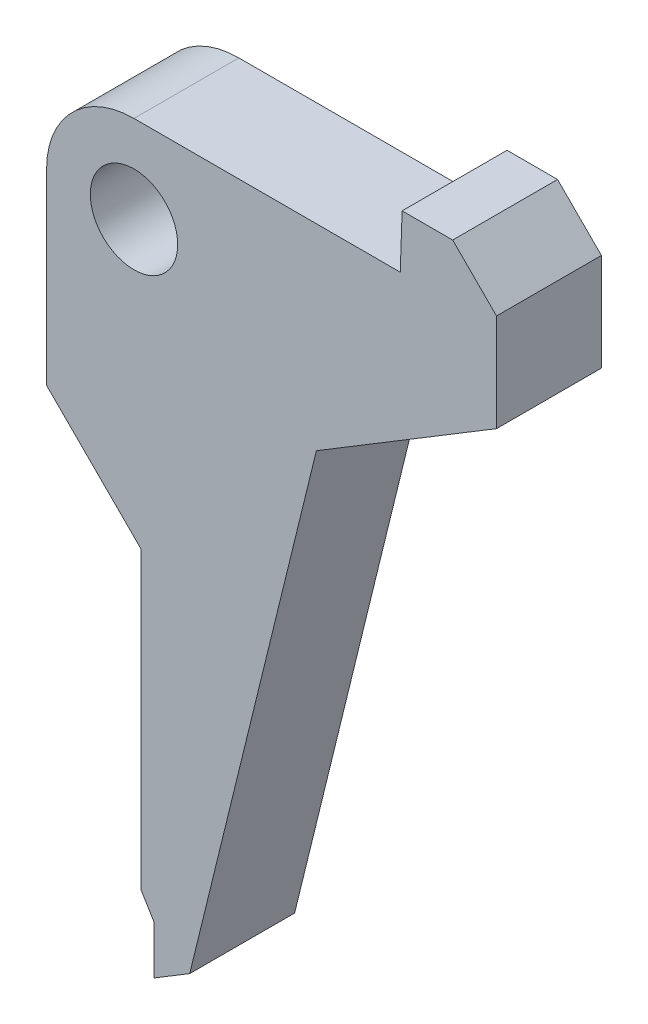
from build123d import *

# Parameters (mm, degrees)
SKETCH_1_R      = 5
SKETCH_1_R_2    = 2.5
EXTRUDE_1_DEPTH = 6


with BuildPart() as part:
    # 스케치1 → 보스-돌출1 (new body)
    # profile 1 of 2: a face of its own
    with BuildSketch(Plane.XY):
        Circle(SKETCH_1_R)
        Circle(SKETCH_1_R_2, mode=Mode.SUBTRACT)
    # profile 2 of 2: a face of its own
    with BuildSketch(Plane.XY):
        with BuildLine():
            Line((15.232380882, 5), (0, 5))
            ThreePointArc((0, 5), (3.535533906, 3.535533906), (5, 0))
            ThreePointArc((5, 0), (0, -5), (-5, 0))
            Line((-5, 0), (-5, -10.728628998))
            Line((-5, -10.728628998), (0.389281966, -16.117910964))
            Line((0.389281966, -16.117910964), (0.389281966, -32.993510276))
            Line((0.389281966, -32.993510276), (1.140402407, -34.2331528))
            Line((1.140402407, -34.2331528), (1.140402407, -37.017391391))
            Line((1.140402407, -37.017391391), (3.188469753, -35.776432632))
            Line((3.188469753, -35.776432632), (10.435477501, -6.24434983))
            Line((10.435477501, -6.24434983), (20.74109717, 0))
            Line((20.74109717, 0), (20.74109717, 5.58326458))
            Line((20.74109717, 5.58326458), (18.231984896, 8.092376853))
            Line((18.231984896, 8.092376853), (15.340369062, 8.092376853))
            Line((15.340369062, 8.092376853), (15.232380882, 5))
        make_face()
    extrude(amount=EXTRUDE_1_DEPTH)


solid = part.part
